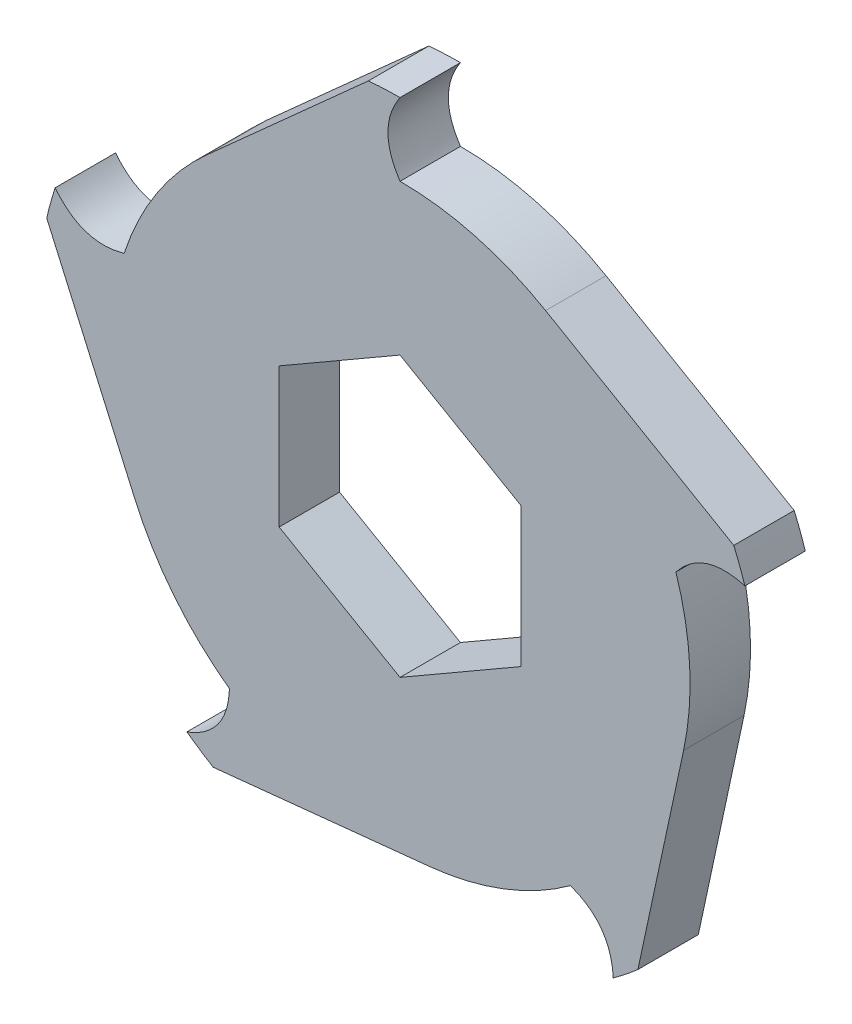
from build123d import *

# Parameters (mm, degrees)
BOSS_EXTRUDE1_DEPTH     = 6.35
CUT_EXTRUDE1_DEPTH      = 44.570440668
CUT_EXTRUDE1_DEPTH_BACK = 44.570440668
BOSS_EXTRUDE2_DEPTH     = 6.35
CIRPATTERN1_COUNT       = 5


with BuildPart() as part:
    # Sketch2 → Boss-Extrude1 (new body)
    with BuildSketch(Plane.XY):
        with BuildLine():
            ThreePointArc((0, 30.48), (-10.890740876, 28.467914626), (-20.34361427, 22.697307295))
            ThreePointArc((-20.34361427, 22.697307295), (-12.428938753, -27.830772204), (30.48, 0))
            ThreePointArc((30.48, 0), (21.552614691, 21.552614691), (0, 30.48))
        make_face()
    extrude(amount=BOSS_EXTRUDE1_DEPTH)

    # Sketch3 → Cut-Extrude1 (cut, two sides: drawn at the far end of the back side and taken through both)
    with BuildSketch(Plane.XY.offset(-CUT_EXTRUDE1_DEPTH_BACK)):
        Polygon((0, 14.664696837), (-12.7, 7.332348419), (-12.7, -7.332348419), (0, -14.664696837), (12.7, -7.332348419), (12.7, 7.332348419), align=None)
    extrude(amount=CUT_EXTRUDE1_DEPTH + CUT_EXTRUDE1_DEPTH_BACK, mode=Mode.SUBTRACT)

    # Sketch2<3> → Boss-Extrude2 (add)
    with BuildSketch(Plane.XY):
        with BuildLine():
            ThreePointArc((0, 38.1), (-1.661898659, 38.063737242), (-3.320633799, 37.955017997))
            Line((-3.320633799, 37.955017997), (-20.34361427, 22.697307295))
            ThreePointArc((-20.34361427, 22.697307295), (-10.890740876, 28.467914626), (0, 30.48))
            add(Edge.make_bspline(
                [(0, 30.48), (-2.54, 34.29), (0, 38.1)],
                knots=[0, 0, 0, 1, 1, 1], degree=2))
        make_face()
    boss_extrude2 = extrude(amount=BOSS_EXTRUDE2_DEPTH)

    # CirPattern1: Boss-Extrude2 ×5 about axis
    cirpattern1_axis = Axis((0, 0, 6.35), (0, 0, 1))
    for i in range(1, CIRPATTERN1_COUNT):
        add(boss_extrude2.rotate(cirpattern1_axis, i * 360 / CIRPATTERN1_COUNT))


solid = part.part
